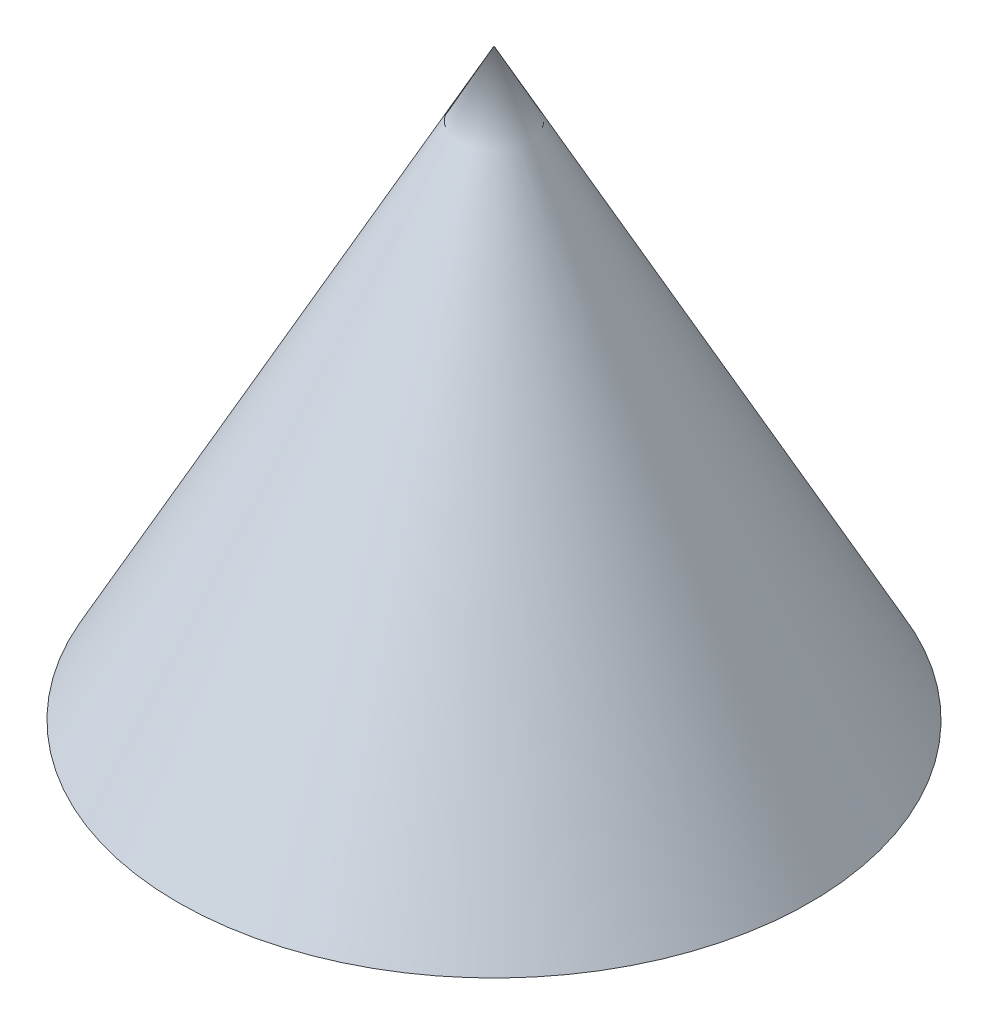
from build123d import *


with BuildPart() as part:
    # ｽｹｯﾁ1 → 回転1 (revolve)
    with BuildSketch(Plane.XY, mode=Mode.PRIVATE) as revolve_1_sk:
        Polygon((0, 0), (0, 6), (-3.25, 0), align=None)
    revolve(revolve_1_sk.sketch.rotate(Axis((0, 0, 0), (0, 1, 0)), 270), axis=Axis((0, 0, 0), (0, 1, 0)))


solid = part.part
